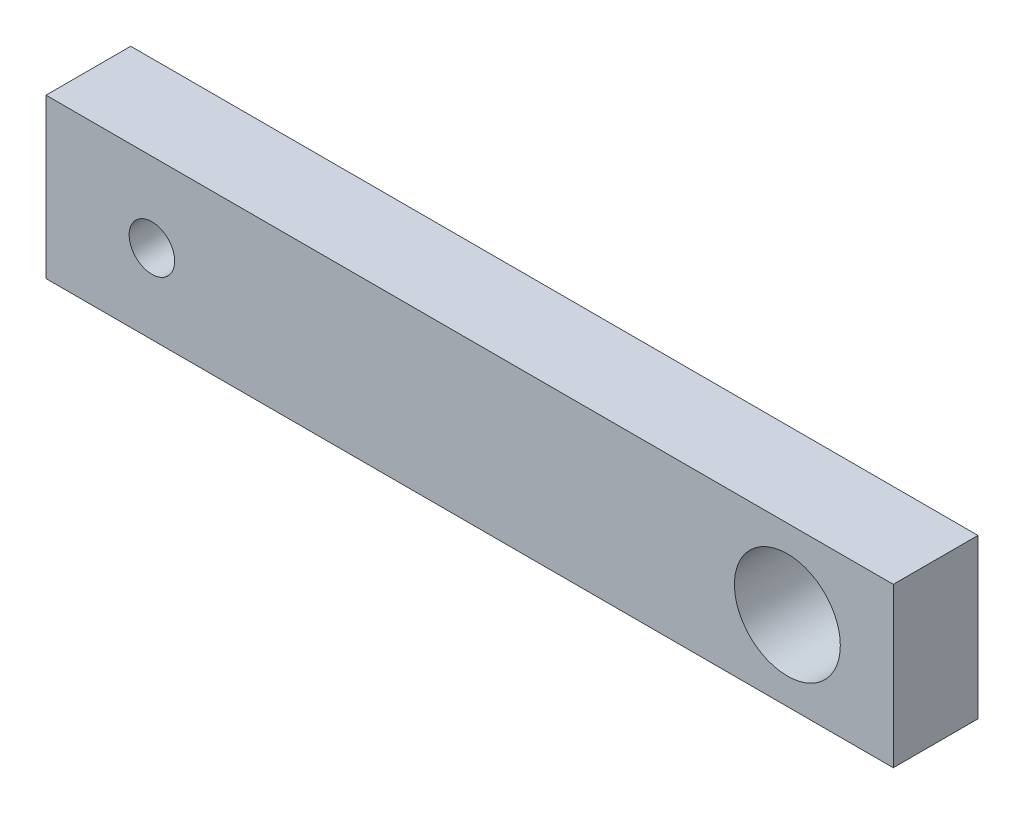
from build123d import *

# Parameters (mm, degrees)
SKETCH1_W           = 80
SKETCH1_H           = 15
SKETCH1_R           = 2.15
SKETCH1_R_2         = 5
BOSS_EXTRUDE1_DEPTH = 8


with BuildPart() as part:
    # Sketch1 → Boss-Extrude1 (new body)
    with BuildSketch(Plane.XY):
        with Locations((40, -7.5)):
            Rectangle(SKETCH1_W, SKETCH1_H)
        with Locations((10, -7.5)):
            Circle(SKETCH1_R, mode=Mode.SUBTRACT)
        with Locations((70, -7.5)):
            Circle(SKETCH1_R_2, mode=Mode.SUBTRACT)
    extrude(amount=BOSS_EXTRUDE1_DEPTH)


solid = part.part
